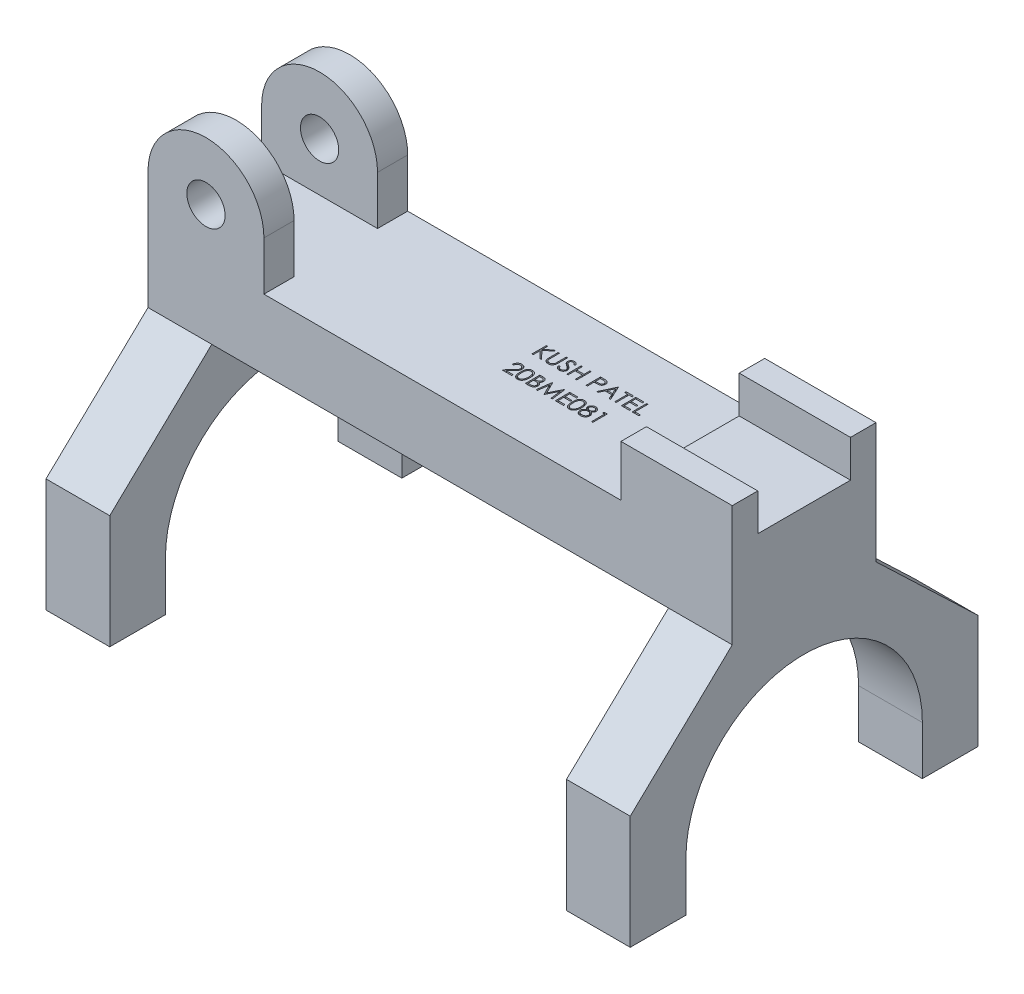
from build123d import *

# Parameters (mm, degrees)
SKETCH1_W             = 13.97
SKETCH1_H             = 46.228
BOSS_EXTRUDE1_DEPTH   = 76.2
BOSS_EXTRUDE1_2_DEPTH = 76.2
CUT_EXTRUDE1_DEPTH    = 128.016
CUT_EXTRUDE2_DEPTH    = 128.016
SKETCH4_W             = 128.016
SKETCH4_H             = 31.496
BOSS_EXTRUDE3_DEPTH   = 15.24
BOSS_EXTRUDE4_DEPTH   = 31.496
SKETCH6_W             = 18.288
SKETCH6_H             = 26.059231169
CUT_EXTRUDE3_DEPTH    = 42.164
SKETCH7_W             = 24.384
SKETCH7_H             = 31.496
BOSS_EXTRUDE5_DEPTH   = 3.048
SKETCH8_W             = 24.384
SKETCH8_H             = 5.588
BOSS_EXTRUDE6_DEPTH   = 8.128
SKETCH9_R             = 4.191
CUT_EXTRUDE4_DEPTH    = 31.496
CUT_EXTRUDE5_DEPTH    = 2.54


with BuildPart() as part:
    # Sketch1 → Boss-Extrude1 (new body)
    with BuildSketch(Plane.XY):
        with Locations((-51.859154672, 23.114)):
            Rectangle(SKETCH1_W, SKETCH1_H)
    extrude(amount=BOSS_EXTRUDE1_DEPTH)


with BuildPart() as body_2:
    # Sketch1 → Boss-Extrude1 2 (new body)
    with BuildSketch(Plane.XY):
        with Locations((62.186845328, 23.114)):
            Rectangle(SKETCH1_W, SKETCH1_H)
    extrude(amount=BOSS_EXTRUDE1_2_DEPTH)


with BuildPart() as cut_extrude1_tool:
    # Sketch2 → Cut-Extrude1 (new body)
    with BuildSketch(Plane(origin=(69.171845328, 0, 0), x_dir=(0, 0, -1), z_dir=(1, 0, 0))):
        with BuildLine():
            Line((-64.008, 10.668), (-64.008, 0))
            Line((-64.008, 0), (-12.192, 0))
            Line((-12.192, 0), (-12.192, 10.668))
            ThreePointArc((-12.192, 10.668), (-38.1, 36.576), (-64.008, 10.668))
        make_face()
    extrude(amount=-CUT_EXTRUDE1_DEPTH)


with BuildPart() as part_1:
    add(part.part)

    # Cut-Extrude1: cut by cut_extrude1_tool
    add(cut_extrude1_tool.part, mode=Mode.SUBTRACT)


with BuildPart() as body_2_1:
    add(body_2.part)

    # Cut-Extrude1: cut by cut_extrude1_tool
    add(cut_extrude1_tool.part, mode=Mode.SUBTRACT)


with BuildPart() as cut_extrude2_tool:
    # Sketch3 → Cut-Extrude2 (new body)
    with BuildSketch(Plane.ZY.offset(58.844154672)):
        Polygon((0, 24.892), (22.352, 46.228), (0, 46.228), align=None)
        Polygon((76.2, 46.228), (53.848, 46.228), (76.2, 24.892), align=None)
    extrude(amount=-CUT_EXTRUDE2_DEPTH)


with BuildPart() as part_2:
    add(part_1.part)

    # Cut-Extrude2: cut by cut_extrude2_tool
    add(cut_extrude2_tool.part, mode=Mode.SUBTRACT)



with BuildPart() as body_2_2:
    add(body_2_1.part)

    # Cut-Extrude2: cut by cut_extrude2_tool
    add(cut_extrude2_tool.part, mode=Mode.SUBTRACT)


with BuildPart() as part_3:
    add(part_2.part)

    add(body_2_2.part)  # Boss-Extrude3 merges body 2
    # Sketch4 → Boss-Extrude3 (add)
    with BuildSketch(Plane(origin=(0, 46.228, 0), x_dir=(1, 0, 0), z_dir=(0, 1, 0))):
        with Locations((5.163845328, -38.1)):
            Rectangle(SKETCH4_W, SKETCH4_H)
    extrude(amount=BOSS_EXTRUDE3_DEPTH)

    # Sketch5 → Boss-Extrude4 (add)
    with BuildSketch(Plane.XY.offset(53.848)):
        with BuildLine():
            Line((-58.844154672, 61.468), (-58.844154672, 72.136))
            ThreePointArc((-58.844154672, 72.136), (-46.144154672, 84.836), (-33.444154672, 72.136))
            Line((-33.444154672, 72.136), (-33.444154672, 61.468))
            Line((-33.444154672, 61.468), (-58.844154672, 61.468))
        make_face()
    extrude(amount=-BOSS_EXTRUDE4_DEPTH)

    # Sketch6 → Cut-Extrude3 (cut)
    with BuildSketch(Plane.ZY.offset(58.844154672)):
        with Locations((38.1, 74.497615585)):
            Rectangle(SKETCH6_W, SKETCH6_H)
    extrude(amount=-CUT_EXTRUDE3_DEPTH, mode=Mode.SUBTRACT)

    # Sketch7 → Boss-Extrude5 (add)
    with BuildSketch(Plane(origin=(0, 61.468, 0), x_dir=(1, 0, 0), z_dir=(0, 1, 0))):
        with Locations((56.979845328, -38.1)):
            Rectangle(SKETCH7_W, SKETCH7_H)
    extrude(amount=BOSS_EXTRUDE5_DEPTH)

    # Sketch8 → Boss-Extrude6 (add)
    with BuildSketch(Plane(origin=(0, 64.516, 0), x_dir=(1, 0, 0), z_dir=(0, 1, 0))):
        with Locations((56.979845328, -51.054)):
            Rectangle(SKETCH8_W, SKETCH8_H)
        with Locations((56.979845328, -25.146)):
            Rectangle(SKETCH8_W, SKETCH8_H)
    extrude(amount=BOSS_EXTRUDE6_DEPTH)

    # Sketch9 → Cut-Extrude4 (cut)
    with BuildSketch(Plane.XY.offset(53.848)):
        with Locations((-46.144154672, 72.136)):
            Circle(SKETCH9_R)
    extrude(amount=-CUT_EXTRUDE4_DEPTH, mode=Mode.SUBTRACT)

    # Sketch10 → Cut-Extrude5 (cut)
    # profile 1 of 17: a face of its own
    with BuildSketch(Plane(origin=(0, 61.468, 0), x_dir=(1, 0, 0), z_dir=(0, 1, 0))):
        Polygon((7.261311191, -32.680807402), (7.546247089, -32.680807402), (7.546247089, -33.889876914), (8.869799773, -32.680807402), (9.276215037, -32.680807402), (7.716063795, -34.10548689), (9.398330422, -35.855807402), (9.018627898, -35.855807402), (7.546247089, -34.323640936), (7.546247089, -35.855807402), (7.261311191, -35.855807402), align=None)
    # profile 2 of 17: a face of its own
    with BuildSketch(Plane(origin=(0, 61.468, 0), x_dir=(1, 0, 0), z_dir=(0, 1, 0))):
        with BuildLine():
            Line((9.866439396, -32.680807402), (10.151375294, -32.680807402))
            Line((10.151375294, -32.680807402), (10.151375294, -34.583136128))
            add(Edge.make_bspline(
                [(10.151375294, -34.583136128), (10.15133289, -34.610060796), (10.151252422, -34.661154992), (10.151789917, -34.733879093), (10.153295201, -34.798533395), (10.154244218, -34.855367118), (10.156355442, -34.904119467), (10.158077241, -34.945054571), (10.160291175, -34.977978597), (10.162951931, -34.997192723), (10.164095646, -35.005451833)],
                knots=[0, 0, 0, 0, 1.528628734, 2.90083645, 4.128790002, 5.200304208, 6.127813768, 6.898992206, 7.526736466, 8, 8, 8, 8], degree=3))
            add(Edge.make_bspline(
                [(10.164095646, -35.005451833), (10.168792341, -35.03524854), (10.177921089, -35.093163016), (10.201186017, -35.175629814), (10.233677607, -35.249953352), (10.27217951, -35.31845288), (10.322918379, -35.379221799), (10.383700158, -35.435203084), (10.457339991, -35.484163222), (10.539219254, -35.528931458), (10.627470863, -35.564913354), (10.717651083, -35.59212162), (10.808404357, -35.608703194), (10.869161306, -35.610623197), (10.899332025, -35.611576633)],
                knots=[0, 0, 0, 0, 1.035780045, 2.013197591, 2.933192213, 3.817615948, 4.702609284, 5.640816605, 6.646850145, 7.73207398, 8.84249596, 9.914020372, 10.964143139, 12, 12, 12, 12], degree=3))
            add(Edge.make_bspline(
                [(10.899332025, -35.611576633), (10.925234346, -35.610602498), (10.976889384, -35.608659853), (11.053639504, -35.59662984), (11.128388174, -35.574948613), (11.201504505, -35.546972546), (11.270040041, -35.51000866), (11.33403302, -35.467308684), (11.391150303, -35.417224532), (11.443272916, -35.361797791), (11.48866175, -35.299259544), (11.528005572, -35.230971519), (11.560232665, -35.15590604), (11.576147148, -35.103151671), (11.58432301, -35.07604979)],
                knots=[0, 0, 0, 0, 0.994687771, 1.983630487, 2.973142513, 3.978332533, 4.983357753, 5.956394766, 6.925816176, 7.893390482, 8.871859704, 9.88551698, 10.913711441, 12, 12, 12, 12], degree=3))
            add(Edge.make_bspline(
                [(11.58432301, -35.07604979), (11.587044552, -35.064847869), (11.593109245, -35.039885475), (11.598776207, -34.997684018), (11.604678556, -34.947891524), (11.608773915, -34.890150237), (11.612766451, -34.82465364), (11.615155024, -34.751060535), (11.616259047, -34.669638149), (11.61658805, -34.612817295), (11.616759909, -34.583136128)],
                knots=[0, 0, 0, 0, 0.558680831, 1.244966039, 2.062412453, 2.990489873, 4.051219941, 5.244515665, 6.560634259, 8, 8, 8, 8], degree=3))
            Line((11.616759909, -34.583136128), (11.616759909, -32.680807402))
            Line((11.616759909, -32.680807402), (11.901695807, -32.680807402))
            Line((11.901695807, -32.680807402), (11.901695807, -34.598400551))
            add(Edge.make_bspline(
                [(11.901695807, -34.598400551), (11.901465283, -34.632961224), (11.901015403, -34.700408477), (11.897114165, -34.799242924), (11.890893887, -34.892998843), (11.882105407, -34.981688836), (11.870460411, -35.064995538), (11.857510747, -35.143649149), (11.841019313, -35.217085078), (11.821757585, -35.285875914), (11.799738009, -35.351358487), (11.771216396, -35.413505587), (11.739081314, -35.474206507), (11.700968022, -35.532543149), (11.658140553, -35.588773808), (11.609652243, -35.642557468), (11.557106754, -35.694753603), (11.499630582, -35.744023313), (11.438171177, -35.789206899), (11.372911359, -35.828937734), (11.304352432, -35.862523444), (11.23267261, -35.890169461), (11.157841305, -35.910956276), (11.079856628, -35.926445882), (10.998541074, -35.935247252), (10.943237422, -35.936555288), (10.915232465, -35.937217659)],
                knots=[0, 0, 0, 0, 1.316592851, 2.569410997, 3.76748051, 4.895814652, 5.963796859, 6.97159953, 7.931736103, 8.829262218, 9.692595152, 10.560224239, 11.431080259, 12.30701507, 13.211635791, 14.121146779, 15.063487852, 16.031507147, 17.00238618, 17.966455255, 18.938106653, 19.907068911, 20.888905087, 21.893141452, 22.933117798, 24, 24, 24, 24], degree=3))
            add(Edge.make_bspline(
                [(10.915232465, -35.937217659), (10.884689779, -35.936505765), (10.824765139, -35.935109031), (10.736465606, -35.927105536), (10.6518163, -35.912030278), (10.569923183, -35.892835186), (10.491901189, -35.866361368), (10.416704993, -35.835429497), (10.345622475, -35.79744084), (10.277500465, -35.755173976), (10.214159437, -35.70761734), (10.156013935, -35.655783039), (10.102967967, -35.600501411), (10.05591565, -35.541173937), (10.014077419, -35.478262031), (9.978036439, -35.411587721), (9.947090853, -35.341176819), (9.931119182, -35.292233559), (9.923044965, -35.267491096)],
                knots=[0, 0, 0, 0, 1.13879206, 2.234305948, 3.301075583, 4.341971843, 5.366689343, 6.369221514, 7.369726634, 8.367512178, 9.355451585, 10.318319045, 11.268648973, 12.207971039, 13.137398894, 14.081662264, 15.030215811, 16, 16, 16, 16], degree=3))
            add(Edge.make_bspline(
                [(9.923044965, -35.267491096), (9.918348543, -35.250588689), (9.908161899, -35.213926993), (9.897253236, -35.153251392), (9.888082855, -35.08338786), (9.879459956, -35.004331613), (9.87437183, -34.916021377), (9.86991101, -34.818495432), (9.86640797, -34.711635852), (9.866428628, -34.637200685), (9.866439396, -34.598400551)],
                knots=[0, 0, 0, 0, 0.625038921, 1.35572334, 2.194682327, 3.136881307, 4.189498639, 5.346923369, 6.617055217, 8, 8, 8, 8], degree=3))
            Line((9.866439396, -34.598400551), (9.866439396, -32.680807402))
        make_face()
    # profile 3 of 17: a face of its own
    with BuildSketch(Plane(origin=(0, 61.468, 0), x_dir=(1, 0, 0), z_dir=(0, 1, 0))):
        with BuildLine():
            Line((12.390157345, -35.243322426), (12.658556784, -35.082409966))
            add(Edge.make_bspline(
                [(12.658556784, -35.082409966), (12.683519757, -35.124196944), (12.731347848, -35.204259181), (12.811132295, -35.312443261), (12.893802865, -35.404393217), (12.97997176, -35.47957414), (13.069113013, -35.538764201), (13.161808548, -35.580676226), (13.25774599, -35.606816432), (13.323036528, -35.60999151), (13.355632105, -35.611576633)],
                knots=[0, 0, 0, 0, 1.272034388, 2.437168799, 3.508375237, 4.49857839, 5.41946034, 6.295179144, 7.148887113, 8, 8, 8, 8], degree=3))
            add(Edge.make_bspline(
                [(13.355632105, -35.611576633), (13.383469471, -35.610801323), (13.438657115, -35.609264269), (13.519902864, -35.594495256), (13.598807785, -35.571805682), (13.67374562, -35.53931098), (13.743682356, -35.499996782), (13.805011287, -35.452511321), (13.858030261, -35.39934712), (13.901399958, -35.340035712), (13.93467399, -35.276248013), (13.960248224, -35.210774114), (13.97444054, -35.142585484), (13.976578452, -35.096674564), (13.977657345, -35.07350572)],
                knots=[0, 0, 0, 0, 1.095163259, 2.171163733, 3.241058638, 4.321873601, 5.38011039, 6.391990106, 7.366004449, 8.327778327, 9.272591725, 10.192022065, 11.087607919, 12, 12, 12, 12], degree=3))
            add(Edge.make_bspline(
                [(13.977657345, -35.07350572), (13.976319935, -35.047070806), (13.973601175, -34.993332489), (13.950621903, -34.914048519), (13.914472944, -34.835587401), (13.881123974, -34.787054111), (13.86381019, -34.761857082)],
                knots=[0, 0, 0, 0, 0.938893495, 1.908633276, 2.914225137, 4, 4, 4, 4], degree=3))
            add(Edge.make_bspline(
                [(13.86381019, -34.761857082), (13.849594704, -34.743671749), (13.81975107, -34.705493917), (13.768445326, -34.64866574), (13.70824178, -34.590047602), (13.641200698, -34.527401172), (13.564879967, -34.463640099), (13.481670008, -34.395723876), (13.389446364, -34.326235302), (13.324767535, -34.279633046), (13.291394324, -34.25558705)],
                knots=[0, 0, 0, 0, 0.722233717, 1.516239348, 2.393582979, 3.351407094, 4.387010283, 5.505090956, 6.712668013, 8, 8, 8, 8], degree=3))
            add(Edge.make_bspline(
                [(13.291394324, -34.25558705), (13.257989699, -34.231793974), (13.1941226, -34.186303425), (13.1048066, -34.118789967), (13.024937694, -34.057064457), (12.954870872, -34.000545817), (12.894636952, -33.949226383), (12.843761286, -33.903598967), (12.803539881, -33.862429594), (12.781173747, -33.835722091), (12.771131904, -33.82373108)],
                knots=[0, 0, 0, 0, 1.452282411, 2.77665338, 3.964542531, 5.026858415, 5.96415736, 6.766646006, 7.446254459, 8, 8, 8, 8], degree=3))
            add(Edge.make_bspline(
                [(12.771131904, -33.82373108), (12.757096095, -33.805042997), (12.729492794, -33.768290373), (12.693056489, -33.71084568), (12.662087391, -33.652041718), (12.637810133, -33.59172047), (12.617366563, -33.530728784), (12.603616154, -33.468270868), (12.595006101, -33.404626979), (12.59412437, -33.361797589), (12.593682986, -33.340357683)],
                knots=[0, 0, 0, 0, 1.068054152, 2.10047183, 3.106115577, 4.101338837, 5.06977816, 6.043150881, 7.020423561, 8, 8, 8, 8], degree=3))
            add(Edge.make_bspline(
                [(12.593682986, -33.340357683), (12.594866997, -33.306766387), (12.597209712, -33.240301787), (12.617022181, -33.143209533), (12.64829402, -33.050511855), (12.692104383, -32.963126481), (12.748580696, -32.883328769), (12.813936687, -32.810200821), (12.891779964, -32.748725035), (12.977189843, -32.695011239), (13.070676695, -32.652968864), (13.168639872, -32.621254261), (13.271235073, -32.603284434), (13.340725059, -32.60070564), (13.375984669, -32.599397146)],
                knots=[0, 0, 0, 0, 1.005424448, 1.989358655, 2.955360095, 3.929531133, 4.905563448, 5.876582895, 6.856512386, 7.866279853, 8.892233794, 9.918561126, 10.94386622, 12, 12, 12, 12], degree=3))
            add(Edge.make_bspline(
                [(13.375984669, -32.599397146), (13.41339896, -32.600687603), (13.487804043, -32.603253912), (13.597250117, -32.625567386), (13.702624481, -32.66248871), (13.787390872, -32.704388421), (13.853732734, -32.746236206), (13.90432657, -32.784354189), (13.955595972, -32.828237323), (14.007954493, -32.878002496), (14.060514948, -32.934106335), (14.114057651, -32.996164603), (14.168707809, -33.06379805), (14.203864911, -33.112080276), (14.221888114, -33.136832042)],
                knots=[0, 0, 0, 0, 1.286793592, 2.559021753, 3.825965368, 5.121522368, 5.803751409, 6.523245864, 7.299691795, 8.125521123, 9.008227632, 9.944561021, 10.946284179, 12, 12, 12, 12], degree=3))
            Line((14.221888114, -33.136832042), (13.964300975, -33.332089454))
            add(Edge.make_bspline(
                [(13.964300975, -33.332089454), (13.948747165, -33.312051856), (13.918794163, -33.273464128), (13.873319557, -33.219424434), (13.830458284, -33.170060913), (13.788230421, -33.12718469), (13.748866198, -33.088447755), (13.710660024, -33.055282833), (13.67416172, -33.027364971), (13.628154236, -32.99757117), (13.570353163, -32.968037771), (13.497795763, -32.943046821), (13.42197107, -32.928029015), (13.370327762, -32.926043381), (13.344183787, -32.925038172)],
                knots=[0, 0, 0, 0, 1.181633172, 2.275549214, 3.290209073, 4.226197932, 5.078386478, 5.862611352, 6.581680152, 7.217281963, 8.414376989, 9.595101626, 10.782541182, 12, 12, 12, 12], degree=3))
            add(Edge.make_bspline(
                [(13.344183787, -32.925038172), (13.311384656, -32.926137357), (13.248134622, -32.928257031), (13.158336336, -32.951407304), (13.077515419, -32.987857991), (13.008071306, -33.038943721), (12.950252763, -33.099469193), (12.908428525, -33.169118583), (12.883255161, -33.246028334), (12.880183322, -33.299678265), (12.878618884, -33.327001313)],
                knots=[0, 0, 0, 0, 1.14458467, 2.207223713, 3.21896685, 4.227309161, 5.202851033, 6.127160689, 7.046193047, 8, 8, 8, 8], degree=3))
            add(Edge.make_bspline(
                [(12.878618884, -33.327001313), (12.878975506, -33.344011582), (12.879689333, -33.378059937), (12.889645042, -33.428362299), (12.902435148, -33.478537585), (12.922703106, -33.528360214), (12.950684203, -33.578701525), (12.987428184, -33.630428387), (13.033704546, -33.683996723), (13.069152979, -33.718837698), (13.087868683, -33.737232683)],
                knots=[0, 0, 0, 0, 0.858281714, 1.717966888, 2.583508476, 3.4729293, 4.427298488, 5.488583878, 6.674047936, 8, 8, 8, 8], degree=3))
            add(Edge.make_bspline(
                [(13.087868683, -33.737232683), (13.094818642, -33.743434842), (13.111330155, -33.758169752), (13.141516173, -33.78229275), (13.181378569, -33.81204955), (13.229876423, -33.848868045), (13.287903958, -33.891577657), (13.355467555, -33.939632291), (13.431814089, -33.994591957), (13.485990398, -34.033016297), (13.514636512, -34.053333444)],
                knots=[0, 0, 0, 0, 0.420754252, 0.999615792, 1.744751191, 2.668019286, 3.750313428, 4.999500688, 6.413464383, 8, 8, 8, 8], degree=3))
            add(Edge.make_bspline(
                [(13.514636512, -34.053333444), (13.549095162, -34.078408106), (13.615819561, -34.126961713), (13.710758937, -34.199910223), (13.796841178, -34.271254985), (13.874368512, -34.340540385), (13.944106851, -34.40724087), (14.005282497, -34.472158898), (14.058518793, -34.534829381), (14.11583137, -34.615177361), (14.174394535, -34.713857344), (14.224687902, -34.834759746), (14.256400117, -34.956132123), (14.260547135, -35.03770861), (14.262593243, -35.077957843)],
                knots=[0, 0, 0, 0, 1.163667725, 2.253281268, 3.268753668, 4.215851969, 5.092017293, 5.902905408, 6.650798638, 7.335211899, 8.59617414, 9.77448103, 10.901945474, 12, 12, 12, 12], degree=3))
            add(Edge.make_bspline(
                [(14.262593243, -35.077957843), (14.261997124, -35.106422503), (14.260816464, -35.162799058), (14.247244778, -35.245580449), (14.227360511, -35.325981309), (14.19739102, -35.403007819), (14.160812155, -35.478069139), (14.114397058, -35.549196306), (14.060596516, -35.617963539), (13.998880172, -35.682537135), (13.931347103, -35.741815469), (13.859969752, -35.794546832), (13.78463129, -35.838514526), (13.705740417, -35.87439279), (13.623279012, -35.902453909), (13.537274808, -35.922785583), (13.447586037, -35.935263978), (13.3866256, -35.936559162), (13.355632105, -35.937217659)],
                knots=[0, 0, 0, 0, 0.983748083, 1.948392443, 2.894712957, 3.844097841, 4.80183111, 5.778335162, 6.776009319, 7.81870978, 8.863265674, 9.881300176, 10.883814829, 11.87499822, 12.874611388, 13.892143829, 14.928324115, 16, 16, 16, 16], degree=3))
            add(Edge.make_bspline(
                [(13.355632105, -35.937217659), (13.331651472, -35.936753944), (13.283992218, -35.935832355), (13.213498617, -35.92768505), (13.144429132, -35.916157892), (13.077650462, -35.897857128), (13.012302239, -35.875653014), (12.948668676, -35.84831324), (12.886718934, -35.815549779), (12.826105841, -35.778089292), (12.766983554, -35.734494053), (12.709906609, -35.683718095), (12.653002276, -35.627161816), (12.597950138, -35.563289376), (12.543636643, -35.493132687), (12.491132657, -35.416035356), (12.439351384, -35.332417328), (12.406861639, -35.273575429), (12.390157345, -35.243322426)],
                knots=[0, 0, 0, 0, 0.915332311, 1.819136955, 2.706846663, 3.586547465, 4.459518054, 5.340707479, 6.227863349, 7.133153174, 8.059268498, 9.028702269, 10.047606654, 11.120612155, 12.245963614, 13.433783089, 14.680604001, 16, 16, 16, 16], degree=3))
        make_face()
    # profile 4 of 17: a face of its own
    with BuildSketch(Plane(origin=(0, 61.468, 0), x_dir=(1, 0, 0), z_dir=(0, 1, 0))):
        Polygon((14.913875294, -32.680807402), (15.198811191, -32.680807402), (15.198811191, -33.983371505), (16.827016319, -33.983371505), (16.827016319, -32.680807402), (17.111952217, -32.680807402), (17.111952217, -35.855807402), (16.827016319, -35.855807402), (16.827016319, -34.309012531), (15.198811191, -34.309012531), (15.198811191, -35.855807402), (14.913875294, -35.855807402), align=None)
    # profile 5 of 17: a face of its own
    with BuildSketch(Plane(origin=(0, 61.468, 0), x_dir=(1, 0, 0), z_dir=(0, 1, 0))):
        with BuildLine():
            Line((19.147208627, -32.680807402), (19.769869885, -32.680807402))
            add(Edge.make_bspline(
                [(19.769869885, -32.680807402), (19.812696921, -32.68085448), (19.894755425, -32.680944682), (20.012425511, -32.683679487), (20.119295768, -32.687332272), (20.215135756, -32.692395847), (20.300240359, -32.698379896), (20.374224481, -32.706772818), (20.43766965, -32.715536086), (20.475684786, -32.724445505), (20.493021928, -32.728508724)],
                knots=[0, 0, 0, 0, 1.415646017, 2.712440637, 3.8905458, 4.950247383, 5.884950622, 6.709939814, 7.411656543, 8, 8, 8, 8], degree=3))
            add(Edge.make_bspline(
                [(20.493021928, -32.728508724), (20.51496892, -32.734515779), (20.558345749, -32.746388339), (20.620848838, -32.770167931), (20.680315541, -32.798363895), (20.736949883, -32.830498469), (20.790055916, -32.867950374), (20.840425967, -32.909201442), (20.887615521, -32.955204079), (20.931359212, -33.005442321), (20.97153185, -33.059072797), (21.006120919, -33.116896106), (21.035083475, -33.177938931), (21.059924014, -33.242158814), (21.077802398, -33.310095036), (21.091270657, -33.381275553), (21.099819233, -33.455692737), (21.100637986, -33.506547045), (21.101054781, -33.532435007)],
                knots=[0, 0, 0, 0, 0.999701418, 1.975846123, 2.934577507, 3.890451536, 4.834027766, 5.787354733, 6.749476667, 7.726910423, 8.712836071, 9.690891519, 10.682875813, 11.679750201, 12.712814741, 13.765529915, 14.8625177, 16, 16, 16, 16], degree=3))
            add(Edge.make_bspline(
                [(21.101054781, -33.532435007), (21.100672489, -33.558540561), (21.099924508, -33.609617842), (21.090947163, -33.684341728), (21.078854775, -33.755750554), (21.06026102, -33.823685984), (21.03590816, -33.887744576), (21.007340369, -33.948905265), (20.972883881, -34.006127538), (20.933291785, -34.059619138), (20.889248553, -34.109430273), (20.840940531, -34.155199979), (20.788562744, -34.196660343), (20.732281652, -34.233904312), (20.671548575, -34.266068223), (20.607284622, -34.294876635), (20.538931211, -34.319071097), (20.491630502, -34.331798367), (20.467581223, -34.338269341)],
                knots=[0, 0, 0, 0, 1.121902311, 2.195077645, 3.232258892, 4.234102512, 5.217864754, 6.176164875, 7.132989551, 8.084763148, 9.034132444, 9.988522005, 10.94243251, 11.903244335, 12.886203696, 13.894208494, 14.929344452, 16, 16, 16, 16], degree=3))
            add(Edge.make_bspline(
                [(20.467581223, -34.338269341), (20.447689999, -34.342499331), (20.404097224, -34.3517696), (20.332303469, -34.362118701), (20.24871444, -34.370952095), (20.153444229, -34.37757527), (20.046578351, -34.383245247), (19.928058996, -34.387752018), (19.797653512, -34.390228386), (19.706693169, -34.390356105), (19.659202818, -34.390422787)],
                knots=[0, 0, 0, 0, 0.601384939, 1.31797006, 2.144135048, 3.087295005, 4.142315834, 5.309527816, 6.595305764, 8, 8, 8, 8], degree=3))
            Line((19.659202818, -34.390422787), (19.432144525, -34.390422787))
            Line((19.432144525, -34.390422787), (19.432144525, -35.855807402))
            Line((19.432144525, -35.855807402), (19.147208627, -35.855807402))
            Line((19.147208627, -35.855807402), (19.147208627, -32.680807402))
        make_face()
        with BuildLine():
            Line((19.432144525, -33.006448428), (19.432144525, -34.064781761))
            Line((19.432144525, -34.064781761), (19.988023932, -34.071777955))
            add(Edge.make_bspline(
                [(19.988023932, -34.071777955), (20.015165579, -34.071791983), (20.067561969, -34.071819063), (20.143250542, -34.068203896), (20.213471825, -34.064030556), (20.278010118, -34.057920111), (20.336894516, -34.04928297), (20.390223203, -34.040563751), (20.437582666, -34.0279496), (20.493008371, -34.010965102), (20.554769693, -33.981997658), (20.621959541, -33.939951686), (20.67890143, -33.886357044), (20.728175885, -33.826097511), (20.767279074, -33.759060444), (20.795904867, -33.687333622), (20.812724345, -33.611652645), (20.814979678, -33.559865547), (20.816118884, -33.533707042)],
                knots=[0, 0, 0, 0, 1.160613943, 2.240541288, 3.23993089, 4.169200891, 5.011653406, 5.7853311, 6.478053781, 7.106038997, 8.262395093, 9.384106736, 10.481365981, 11.59014053, 12.70357646, 13.786202915, 14.881775077, 16, 16, 16, 16], degree=3))
            add(Edge.make_bspline(
                [(20.816118884, -33.533707042), (20.814973483, -33.50818139), (20.812696568, -33.457439554), (20.795773035, -33.383073107), (20.767334729, -33.312102147), (20.727913389, -33.245905134), (20.68006965, -33.185862433), (20.624462389, -33.133704325), (20.561222502, -33.091774637), (20.502395892, -33.064711589), (20.450143388, -33.048187732), (20.404757253, -33.036626341), (20.353512141, -33.027395612), (20.296391369, -33.019921206), (20.23383767, -33.013522709), (20.165313627, -33.009181144), (20.091078822, -33.006639823), (20.039543519, -33.006513771), (20.012828619, -33.006448428)],
                knots=[0, 0, 0, 0, 1.120700087, 2.227813068, 3.331159281, 4.466773991, 5.599788987, 6.693661531, 7.80175334, 8.91857717, 9.525282508, 10.207424825, 10.974604443, 11.810962634, 12.737642355, 13.736264703, 14.826523623, 16, 16, 16, 16], degree=3))
            Line((20.012828619, -33.006448428), (19.432144525, -33.006448428))
        make_face(mode=Mode.SUBTRACT)
    # profile 6 of 17: a face of its own
    with BuildSketch(Plane(origin=(0, 61.468, 0), x_dir=(1, 0, 0), z_dir=(0, 1, 0))):
        Polygon((23.054900935, -32.680807402), (24.52028555, -35.855807402), (24.210544965, -35.855807402), (23.741163956, -34.838179197), (22.301856063, -34.838179197), (21.819118683, -35.855807402), (21.508106063, -35.855807402), (23.014195807, -32.680807402), align=None)
        Polygon((23.031368283, -33.299652555), (22.456408347, -34.512538172), (23.591063795, -34.512538172), align=None, mode=Mode.SUBTRACT)
    # profile 7 of 17: a face of its own
    with BuildSketch(Plane(origin=(0, 61.468, 0), x_dir=(1, 0, 0), z_dir=(0, 1, 0))):
        Polygon((24.723811191, -33.006448428), (24.723811191, -32.680807402), (26.392721448, -32.680807402), (26.392721448, -33.006448428), (25.700734268, -33.006448428), (25.700734268, -35.855807402), (25.415798371, -35.855807402), (25.415798371, -33.006448428), align=None)
    # profile 8 of 17: a face of its own
    with BuildSketch(Plane(origin=(0, 61.468, 0), x_dir=(1, 0, 0), z_dir=(0, 1, 0))):
        Polygon((26.881182986, -32.680807402), (28.672208627, -32.680807402), (28.672208627, -33.006448428), (27.166118884, -33.006448428), (27.166118884, -33.983371505), (28.672208627, -33.983371505), (28.672208627, -34.309012531), (27.166118884, -34.309012531), (27.166118884, -35.530166377), (28.672208627, -35.530166377), (28.672208627, -35.855807402), (26.881182986, -35.855807402), align=None)
    # profile 9 of 17: a face of its own
    with BuildSketch(Plane(origin=(0, 61.468, 0), x_dir=(1, 0, 0), z_dir=(0, 1, 0))):
        Polygon((29.242080422, -32.680807402), (29.527016319, -32.680807402), (29.527016319, -35.530166377), (30.748170166, -35.530166377), (30.748170166, -35.855807402), (29.242080422, -35.855807402), align=None)
    # profile 10 of 17: a face of its own
    with BuildSketch(Plane(origin=(0, 61.468, 0), x_dir=(1, 0, 0), z_dir=(0, 1, 0))):
        with BuildLine():
            Line((7.383426576, -39.949397146), (7.098490678, -39.949397146))
            add(Edge.make_bspline(
                [(7.098490678, -39.949397146), (7.100347739, -39.911595698), (7.103994956, -39.83735466), (7.121074904, -39.72911083), (7.145514128, -39.625646834), (7.180068518, -39.527793412), (7.22298207, -39.434685351), (7.274444309, -39.34669248), (7.335398731, -39.264150473), (7.404529125, -39.187824522), (7.479612105, -39.117804369), (7.56062535, -39.057338541), (7.645756196, -39.006250368), (7.734746366, -38.963540956), (7.828599877, -38.931482667), (7.926465041, -38.907695894), (8.028771829, -38.893384495), (8.098476706, -38.891846175), (8.133927377, -38.891063813)],
                knots=[0, 0, 0, 0, 1.10065271, 2.161652631, 3.183658789, 4.190468796, 5.17591951, 6.163126047, 7.15150782, 8.156236427, 9.156009102, 10.134482811, 11.092018607, 12.041330605, 13.001268258, 13.972401359, 14.968799086, 16, 16, 16, 16], degree=3))
            add(Edge.make_bspline(
                [(8.133927377, -38.891063813), (8.168741773, -38.891878841), (8.237150817, -38.893480343), (8.336992787, -38.907233562), (8.432040762, -38.928774206), (8.52210895, -38.958996048), (8.606478737, -38.999621921), (8.685783927, -39.048423974), (8.760968663, -39.10486625), (8.828647674, -39.171317923), (8.890794288, -39.242258658), (8.944408477, -39.317994113), (8.990321847, -39.396216394), (9.028592099, -39.477521977), (9.056764454, -39.56267641), (9.078153257, -39.650439944), (9.090243125, -39.741721022), (9.092098616, -39.803503398), (9.09304196, -39.834913973)],
                knots=[0, 0, 0, 0, 1.111607364, 2.184268762, 3.212621178, 4.221274766, 5.211760367, 6.196651075, 7.1921475, 8.207485113, 9.220403448, 10.201281604, 11.166441695, 12.114753415, 13.065576456, 14.026450734, 14.996634279, 16, 16, 16, 16], degree=3))
            add(Edge.make_bspline(
                [(9.09304196, -39.834913973), (9.091505929, -39.879135223), (9.088460822, -39.966801702), (9.06241278, -40.095629471), (9.021730588, -40.220446358), (8.972747271, -40.320900911), (8.923332983, -40.401848437), (8.878803601, -40.468495048), (8.826674808, -40.540255009), (8.766187885, -40.616888022), (8.698594065, -40.698994343), (8.623281103, -40.786524372), (8.539711944, -40.878573763), (8.481057447, -40.941443844), (8.450664156, -40.974021545)],
                knots=[0, 0, 0, 0, 1.184426356, 2.348067706, 3.509069118, 4.696110526, 5.333549288, 6.050745305, 6.844228056, 7.710549037, 8.667450064, 9.695053472, 10.805634456, 12, 12, 12, 12], degree=3))
            Line((8.450664156, -40.974021545), (7.656278138, -41.821833043))
            Line((7.656278138, -41.821833043), (9.133747089, -41.821833043))
            Line((9.133747089, -41.821833043), (9.133747089, -42.147474069))
            Line((9.133747089, -42.147474069), (6.976375294, -42.147474069))
            Line((6.976375294, -42.147474069), (8.207705422, -40.833461649))
            add(Edge.make_bspline(
                [(8.207705422, -40.833461649), (8.237684576, -40.802166757), (8.295268397, -40.742055673), (8.37671402, -40.654295988), (8.449865102, -40.572880333), (8.515195166, -40.497962536), (8.571286988, -40.428446756), (8.621063942, -40.366584418), (8.660947014, -40.309657167), (8.704231694, -40.243671038), (8.746154377, -40.163105579), (8.782179157, -40.064650018), (8.804145484, -39.963297439), (8.806780585, -39.894806305), (8.808106063, -39.860354678)],
                knots=[0, 0, 0, 0, 1.329631726, 2.553950428, 3.673215718, 4.687767853, 5.603093632, 6.413772471, 7.123043292, 7.734684054, 8.834405432, 9.900288307, 10.943827018, 12, 12, 12, 12], degree=3))
            add(Edge.make_bspline(
                [(8.808106063, -39.860354678), (8.807529354, -39.838690838), (8.806392771, -39.795995569), (8.79636186, -39.733397488), (8.781203044, -39.673013693), (8.759481274, -39.614658445), (8.730809445, -39.558918461), (8.695908593, -39.50572589), (8.655640464, -39.4543009), (8.609057527, -39.406083265), (8.55788422, -39.361922457), (8.503823722, -39.322802751), (8.44662827, -39.290110129), (8.386539017, -39.263309957), (8.323723484, -39.242286575), (8.258060179, -39.22771915), (8.189730536, -39.218572896), (8.143073008, -39.217335398), (8.119298972, -39.216704838)],
                knots=[0, 0, 0, 0, 0.991446411, 1.95395049, 2.89581595, 3.838931463, 4.798493298, 5.75982156, 6.748411868, 7.785213223, 8.824556874, 9.840280684, 10.836137867, 11.835679398, 12.848801643, 13.863922112, 14.911575587, 16, 16, 16, 16], degree=3))
            add(Edge.make_bspline(
                [(8.119298972, -39.216704838), (8.094469716, -39.217353475), (8.045709158, -39.218627289), (7.974118321, -39.227537849), (7.905823366, -39.242910147), (7.840652497, -39.263934702), (7.778495444, -39.290657814), (7.71965449, -39.323942468), (7.664261726, -39.363660351), (7.612213023, -39.408691427), (7.564257842, -39.458827037), (7.52212389, -39.514716075), (7.485308391, -39.575338087), (7.453187158, -39.640529501), (7.427101639, -39.710881858), (7.407168853, -39.786145419), (7.391396499, -39.865993387), (7.386127341, -39.921134142), (7.383426576, -39.949397146)],
                knots=[0, 0, 0, 0, 1.031018746, 2.02475058, 2.990194455, 3.934040569, 4.864654155, 5.795059489, 6.735614925, 7.690564532, 8.649604399, 9.611025574, 10.590972636, 11.591080095, 12.624614302, 13.701020113, 14.821632451, 16, 16, 16, 16], degree=3))
        make_face()
    # profile 11 of 17: a face of its own
    with BuildSketch(Plane(origin=(0, 61.468, 0), x_dir=(1, 0, 0), z_dir=(0, 1, 0))):
        with BuildLine():
            add(Edge.make_bspline(
                [(9.418682986, -40.561246104), (9.418980545, -40.51035776), (9.419558559, -40.411506417), (9.425988769, -40.267466063), (9.436670687, -40.132337801), (9.451309589, -40.006115162), (9.469124043, -39.888765562), (9.492905234, -39.780602603), (9.519949705, -39.681125675), (9.55129371, -39.590010388), (9.586661204, -39.506029186), (9.62515514, -39.427629182), (9.668303204, -39.354929), (9.713639404, -39.28676829), (9.762998926, -39.224262796), (9.814977114, -39.166529809), (9.871602673, -39.114903628), (9.930950688, -39.067871625), (9.993558481, -39.026642462), (10.057641471, -38.990327049), (10.123640745, -38.959302884), (10.191736497, -38.934909417), (10.261316674, -38.914761006), (10.332624513, -38.90098246), (10.405777751, -38.892312979), (10.455154838, -38.891484152), (10.480196408, -38.891063813)],
                knots=[0, 0, 0, 0, 1.646270934, 3.197905019, 4.663502075, 6.030701355, 7.308322542, 8.50163776, 9.611534131, 10.641858119, 11.616356847, 12.558055219, 13.465016945, 14.349605745, 15.204443733, 16.039544428, 16.859896111, 17.680448484, 18.487036065, 19.28249412, 20.06191084, 20.843045899, 21.620316918, 22.403196591, 23.190181807, 24, 24, 24, 24], degree=3))
            add(Edge.make_bspline(
                [(10.480196408, -38.891063813), (10.505447163, -38.891506331), (10.555662971, -38.89238636), (10.629903883, -38.900844508), (10.702429666, -38.914879027), (10.77293112, -38.934764482), (10.841987358, -38.959434846), (10.909058242, -38.990356731), (10.97456038, -39.026351132), (11.037452855, -39.068645649), (11.098426114, -39.115801), (11.15598248, -39.169107135), (11.210127194, -39.228025809), (11.261539792, -39.291926642), (11.308761655, -39.362035255), (11.35373184, -39.437132269), (11.393983616, -39.518530982), (11.432750071, -39.604873264), (11.466211837, -39.698548154), (11.496389074, -39.799027615), (11.520772139, -39.907498485), (11.541082407, -40.02339165), (11.556816706, -40.147132724), (11.568276317, -40.278456453), (11.574329758, -40.417449236), (11.575469766, -40.512479571), (11.576054781, -40.561246104)],
                knots=[0, 0, 0, 0, 0.810914788, 1.612654377, 2.396697861, 3.181598691, 3.963628158, 4.749916497, 5.551656086, 6.361998678, 7.18212741, 8.025565596, 8.878627764, 9.750805457, 10.657531673, 11.591944965, 12.560506719, 13.57287815, 14.630710178, 15.753379473, 16.941251878, 18.199788006, 19.531962791, 20.947069417, 22.433333509, 24, 24, 24, 24], degree=3))
            add(Edge.make_bspline(
                [(11.576054781, -40.561246104), (11.575463701, -40.609799935), (11.574312005, -40.704405094), (11.568344178, -40.842772479), (11.556588848, -40.973399275), (11.541884073, -41.096598766), (11.521517843, -41.211858178), (11.496476013, -41.319576356), (11.468671792, -41.420218478), (11.434350229, -41.512960057), (11.396784798, -41.599094834), (11.355913299, -41.679528605), (11.312125671, -41.754972313), (11.264420167, -41.824822083), (11.213571713, -41.889572722), (11.158492005, -41.94808128), (11.100733688, -42.001757532), (11.039580997, -42.04952008), (10.975707661, -42.091325582), (10.910430498, -42.128712432), (10.842591286, -42.158859234), (10.773727394, -42.184744592), (10.702853804, -42.204520716), (10.630058864, -42.218194857), (10.55571285, -42.227785034), (10.505455716, -42.228516626), (10.480196408, -42.228884325)],
                knots=[0, 0, 0, 0, 1.561518951, 3.042555995, 4.452378317, 5.7783523, 7.031515105, 8.214008947, 9.334062868, 10.386615937, 11.391082383, 12.354592575, 13.286541444, 14.194233754, 15.072674879, 15.931287219, 16.775624067, 17.606195743, 18.42308326, 19.229000347, 20.022332153, 20.807536673, 21.593273796, 22.3848459, 23.188221202, 24, 24, 24, 24], degree=3))
            add(Edge.make_bspline(
                [(10.480196408, -42.228884325), (10.455155533, -42.228461274), (10.405779815, -42.2276271), (10.332616544, -42.218996787), (10.261603184, -42.20512158), (10.192389314, -42.185693661), (10.124619833, -42.161913059), (10.059218201, -42.130930789), (9.995457231, -42.09524917), (9.933507034, -42.054613323), (9.874531717, -42.008057225), (9.81819941, -41.956563906), (9.765925286, -41.898848383), (9.717271499, -41.835821981), (9.671030719, -41.76806454), (9.628495359, -41.694650944), (9.589151798, -41.61587229), (9.553189489, -41.531219614), (9.52130463, -41.439457644), (9.493139923, -41.339536603), (9.470902081, -41.230574562), (9.451867543, -41.113446665), (9.436514709, -40.987649599), (9.426033286, -40.853115072), (9.419555093, -40.709926918), (9.418978993, -40.611710766), (9.418682986, -40.561246104)],
                knots=[0, 0, 0, 0, 0.810891512, 1.598919785, 2.382837074, 3.152667961, 3.926044502, 4.706494248, 5.493654104, 6.291793342, 7.103789334, 7.925228297, 8.761435821, 9.622817696, 10.50288917, 11.416980706, 12.369136599, 13.353924996, 14.394355917, 15.514179734, 16.714354668, 17.994756427, 19.357759367, 20.818452758, 22.365282078, 24, 24, 24, 24], degree=3))
        make_face()
        with BuildLine():
            add(Edge.make_bspline(
                [(9.703618884, -40.559974069), (9.703727239, -40.602381817), (9.703937536, -40.684686929), (9.709431375, -40.804287602), (9.716915514, -40.915839257), (9.726568691, -41.019483537), (9.740904223, -41.114869619), (9.756966809, -41.202653546), (9.776514004, -41.282370754), (9.799641628, -41.354568268), (9.825984237, -41.420471352), (9.854745985, -41.481795311), (9.885643926, -41.539264568), (9.920223441, -41.592362913), (9.957883534, -41.641263504), (9.997773562, -41.686831859), (10.041382264, -41.727469121), (10.101710659, -41.776207054), (10.181354604, -41.826570839), (10.281703159, -41.870427649), (10.384816683, -41.897988878), (10.454803888, -41.901493856), (10.489736672, -41.9032433)],
                knots=[0, 0, 0, 0, 1.459021318, 2.831673884, 4.118529203, 5.306027144, 6.411944654, 7.436330062, 8.375795394, 9.233974572, 10.042671642, 10.816086306, 11.563610507, 12.285937304, 12.993564865, 13.685989202, 14.367179055, 15.041617293, 16.353048772, 17.594441528, 18.799311195, 20, 20, 20, 20], degree=3))
            add(Edge.make_bspline(
                [(10.489736672, -41.9032433), (10.524895417, -41.901793884), (10.595140317, -41.898898046), (10.697768831, -41.870959191), (10.797400576, -41.828804681), (10.875480122, -41.778959443), (10.934882144, -41.731490173), (10.977442556, -41.691018314), (11.016505986, -41.645701205), (11.053555582, -41.596806844), (11.087536315, -41.543401091), (11.118436447, -41.485740755), (11.146633484, -41.423665715), (11.162698119, -41.380331737), (11.170911552, -41.358176192)],
                knots=[0, 0, 0, 0, 1.353760809, 2.704726607, 4.075137775, 5.516104923, 6.260822281, 7.007110065, 7.778089737, 8.566572457, 9.372053459, 10.217411131, 11.088608312, 12, 12, 12, 12], degree=3))
            add(Edge.make_bspline(
                [(11.170911552, -41.358176192), (11.180483513, -41.329846357), (11.199918698, -41.272324643), (11.224966522, -41.183094758), (11.244692705, -41.089475108), (11.262439473, -40.992025181), (11.274552602, -40.890026309), (11.284302404, -40.783794089), (11.290045242, -40.673248425), (11.290757123, -40.59814154), (11.291118884, -40.559974069)],
                knots=[0, 0, 0, 0, 0.884706709, 1.796334032, 2.740027952, 3.714592787, 4.726048262, 5.777819803, 6.87074269, 8, 8, 8, 8], degree=3))
            add(Edge.make_bspline(
                [(11.291118884, -40.559974069), (11.290619783, -40.521812771), (11.289643437, -40.447161114), (11.285911462, -40.337833908), (11.276274362, -40.233995296), (11.265570876, -40.135197939), (11.249789111, -40.041988736), (11.232773101, -39.953587387), (11.209912001, -39.871089072), (11.185491919, -39.793202166), (11.157542489, -39.720811572), (11.126776073, -39.65357978), (11.093917763, -39.591182208), (11.058228731, -39.533790054), (11.020132647, -39.481146247), (10.978624013, -39.434306294), (10.935349332, -39.391818473), (10.874736599, -39.343320285), (10.795384922, -39.29387039), (10.69664637, -39.248362879), (10.593893714, -39.222229642), (10.524430653, -39.218545112), (10.489736672, -39.216704838)],
                knots=[0, 0, 0, 0, 1.31362396, 2.569729283, 3.763502607, 4.902122613, 5.988968491, 7.01645872, 7.998833611, 8.933434873, 9.825090667, 10.667526885, 11.477055099, 12.250526234, 12.991942729, 13.710640831, 14.402115721, 15.076753259, 16.378508321, 17.609869233, 18.806226677, 20, 20, 20, 20], degree=3))
            add(Edge.make_bspline(
                [(10.489736672, -39.216704838), (10.454620635, -39.218547651), (10.384324588, -39.222236632), (10.280503943, -39.248265512), (10.180986424, -39.293634417), (10.101844583, -39.343484069), (10.041189576, -39.390962395), (9.998478847, -39.432134392), (9.958431963, -39.477170637), (9.921540549, -39.526520946), (9.886988128, -39.579557386), (9.855255352, -39.636697194), (9.826664632, -39.698229932), (9.800280802, -39.764103412), (9.77708263, -39.836294698), (9.757947392, -39.915913713), (9.740269851, -40.00341843), (9.727755572, -40.099321126), (9.716630593, -40.202991365), (9.709481085, -40.314821504), (9.703919158, -40.434622763), (9.70372098, -40.517353428), (9.703618884, -40.559974069)],
                knots=[0, 0, 0, 0, 1.207732386, 2.417664972, 3.655092373, 4.956220595, 5.625982001, 6.301752483, 6.994047911, 7.697131622, 8.419323945, 9.170223765, 9.943494443, 10.752040957, 11.610060368, 12.549350801, 13.567764191, 14.679664412, 15.874934091, 17.154273443, 18.533957287, 20, 20, 20, 20], degree=3))
        make_face(mode=Mode.SUBTRACT)
    # profile 12 of 17: a face of its own
    with BuildSketch(Plane(origin=(0, 61.468, 0), x_dir=(1, 0, 0), z_dir=(0, 1, 0))):
        with BuildLine():
            Line((12.145926576, -38.972474069), (12.765407746, -38.972474069))
            add(Edge.make_bspline(
                [(12.765407746, -38.972474069), (12.795732151, -38.9726335), (12.854508395, -38.972942516), (12.939978889, -38.977735071), (13.020033167, -38.984269829), (13.094694446, -38.994638555), (13.163928226, -39.007149668), (13.227943154, -39.022300601), (13.286535668, -39.0404676), (13.356487936, -39.069356727), (13.436244535, -39.112285601), (13.522603077, -39.175720799), (13.596448352, -39.253310962), (13.660117368, -39.340834514), (13.710736955, -39.437114821), (13.747357675, -39.539857085), (13.770542319, -39.647736094), (13.772926684, -39.72179812), (13.774131704, -39.759227875)],
                knots=[0, 0, 0, 0, 1.001505555, 1.941167018, 2.826882275, 3.653841531, 4.429895133, 5.150066043, 5.825578002, 6.45369114, 7.647487171, 8.808567382, 9.977351308, 11.170798116, 12.373658725, 13.556498008, 14.765093433, 16, 16, 16, 16], degree=3))
            add(Edge.make_bspline(
                [(13.774131704, -39.759227875), (13.773139999, -39.794291265), (13.771191204, -39.863194132), (13.752555987, -39.96397236), (13.723381666, -40.059903823), (13.682827619, -40.150638415), (13.630120808, -40.23412605), (13.567656476, -40.311040213), (13.492293948, -40.378124386), (13.435830437, -40.415628305), (13.407149533, -40.434678596)],
                knots=[0, 0, 0, 0, 1.044552857, 2.05264487, 3.044412934, 4.028983338, 5.005914585, 5.980388656, 6.974128949, 8, 8, 8, 8], degree=3))
            add(Edge.make_bspline(
                [(13.407149533, -40.434678596), (13.44321792, -40.448526131), (13.512225681, -40.475019895), (13.60719085, -40.521860638), (13.689010459, -40.572807695), (13.758313584, -40.628444445), (13.817584171, -40.68841458), (13.86933934, -40.753597434), (13.913500301, -40.824843307), (13.951339881, -40.901409371), (13.980866253, -40.98251381), (14.00297868, -41.067395872), (14.015649152, -41.155751182), (14.017452227, -41.215881491), (14.018362473, -41.24623709)],
                knots=[0, 0, 0, 0, 1.27268992, 2.434971085, 3.483601985, 4.442670788, 5.356604649, 6.2567628, 7.179492994, 8.113709626, 9.066344395, 10.018646069, 10.999752585, 12, 12, 12, 12], degree=3))
            add(Edge.make_bspline(
                [(14.018362473, -41.24623709), (14.017476334, -41.277231324), (14.015732831, -41.338213348), (14.002869571, -41.427798362), (13.981089881, -41.513409921), (13.951089627, -41.595601765), (13.911935242, -41.674214887), (13.864284874, -41.749338348), (13.807469098, -41.820217348), (13.743912067, -41.887639492), (13.672009978, -41.948261842), (13.594434972, -42.00225109), (13.510210096, -42.046652161), (13.420718644, -42.083950266), (13.324956729, -42.112441082), (13.223354364, -42.132373345), (13.115999176, -42.145803629), (13.04233033, -42.146907808), (13.004550374, -42.147474069)],
                knots=[0, 0, 0, 0, 0.978564426, 1.925352924, 2.850884081, 3.763762016, 4.682927383, 5.618979971, 6.567305752, 7.547517671, 8.540179244, 9.531824382, 10.526200242, 11.540722885, 12.589160233, 13.674978461, 14.80764778, 16, 16, 16, 16], degree=3))
            Line((13.004550374, -42.147474069), (12.145926576, -42.147474069))
            Line((12.145926576, -42.147474069), (12.145926576, -38.972474069))
        make_face()
        with BuildLine():
            Line((12.430862473, -39.298115095), (12.430862473, -40.3157433))
            Line((12.430862473, -40.3157433), (12.622303779, -40.3157433))
            add(Edge.make_bspline(
                [(12.622303779, -40.3157433), (12.650288044, -40.315380512), (12.704359345, -40.314679533), (12.782663823, -40.312671557), (12.855348661, -40.307049046), (12.922288395, -40.301428152), (12.983377612, -40.292289061), (13.038480972, -40.281410493), (13.088463271, -40.269905286), (13.146102716, -40.25033868), (13.211483176, -40.221421075), (13.281181778, -40.176543052), (13.342626618, -40.123090246), (13.394512638, -40.06141273), (13.436977329, -39.993498405), (13.466471914, -39.920430877), (13.48647195, -39.844031186), (13.488278554, -39.791581771), (13.489195807, -39.764952034)],
                knots=[0, 0, 0, 0, 1.156816544, 2.235205308, 3.236616184, 4.169592532, 5.011045266, 5.787822928, 6.49130361, 7.128639758, 8.301311294, 9.436451833, 10.541879658, 11.654887649, 12.756523258, 13.837046038, 14.901820046, 16, 16, 16, 16], degree=3))
            add(Edge.make_bspline(
                [(13.489195807, -39.764952034), (13.488718486, -39.747330084), (13.48778217, -39.712762705), (13.480113816, -39.662371505), (13.467080374, -39.614978958), (13.450339694, -39.569935587), (13.426945669, -39.528649837), (13.39940167, -39.489694224), (13.366122508, -39.454395373), (13.32824266, -39.421403043), (13.284691981, -39.39215265), (13.235496452, -39.366534243), (13.179990488, -39.34590511), (13.119109541, -39.327838314), (13.051916483, -39.315148934), (12.979186709, -39.304577646), (12.9003245, -39.299195802), (12.8457643, -39.298483365), (12.817561191, -39.298115095)],
                knots=[0, 0, 0, 0, 0.91205012, 1.789085906, 2.630437955, 3.453916878, 4.269457761, 5.079663411, 5.91843418, 6.774407191, 7.675494373, 8.627863946, 9.638891023, 10.736472738, 11.911756761, 13.175263542, 14.539845004, 16, 16, 16, 16], degree=3))
            Line((12.817561191, -39.298115095), (12.430862473, -39.298115095))
        make_face(mode=Mode.SUBTRACT)
        with BuildLine():
            Line((12.430862473, -40.641384325), (12.430862473, -41.821833043))
            Line((12.430862473, -41.821833043), (12.83664172, -41.821833043))
            add(Edge.make_bspline(
                [(12.83664172, -41.821833043), (12.86568746, -41.82148493), (12.921669295, -41.820813986), (13.002496839, -41.81862364), (13.077411512, -41.813641362), (13.146071463, -41.805798341), (13.209218088, -41.797290748), (13.266093862, -41.785850514), (13.31715983, -41.772743243), (13.376372952, -41.752482958), (13.443051135, -41.721008303), (13.514906697, -41.673551826), (13.578793338, -41.617015682), (13.633045252, -41.551582639), (13.677507034, -41.480434221), (13.709851626, -41.40500951), (13.729800474, -41.326554782), (13.732215442, -41.27306355), (13.733426576, -41.24623709)],
                knots=[0, 0, 0, 0, 1.160039823, 2.235823828, 3.228722157, 4.157150951, 4.99529583, 5.772374946, 6.472645482, 7.099169577, 8.269452708, 9.405989375, 10.527446681, 11.663510218, 12.788923519, 13.866172445, 14.929861265, 16, 16, 16, 16], degree=3))
            add(Edge.make_bspline(
                [(13.733426576, -41.24623709), (13.73317611, -41.229460988), (13.732679218, -41.196179385), (13.72518566, -41.147270034), (13.714287364, -41.099893706), (13.700198134, -41.053921756), (13.679679046, -41.010185336), (13.655724538, -40.967819443), (13.627638123, -40.926768072), (13.583873773, -40.874868385), (13.520217758, -40.815072238), (13.429769469, -40.756527504), (13.326924599, -40.709312707), (13.252332516, -40.689265325), (13.213800174, -40.678909365)],
                knots=[0, 0, 0, 0, 0.723448775, 1.435228256, 2.130040452, 2.821711965, 3.505591119, 4.210454504, 4.921174351, 5.648778258, 7.137944449, 8.670945889, 10.280296675, 12, 12, 12, 12], degree=3))
            add(Edge.make_bspline(
                [(13.213800174, -40.678909365), (13.198352351, -40.675775111), (13.164858285, -40.6689794), (13.110241408, -40.661805983), (13.047888156, -40.655415108), (12.977654546, -40.650687843), (12.899451719, -40.645801479), (12.813112657, -40.643901177), (12.71898995, -40.641633991), (12.653682583, -40.641469676), (12.619759709, -40.641384325)],
                knots=[0, 0, 0, 0, 0.634451884, 1.375622551, 2.216452059, 3.157844607, 4.20941857, 5.370758133, 6.634282058, 8, 8, 8, 8], degree=3))
            Line((12.619759709, -40.641384325), (12.430862473, -40.641384325))
        make_face(mode=Mode.SUBTRACT)
    # profile 13 of 17: a face of its own
    with BuildSketch(Plane(origin=(0, 61.468, 0), x_dir=(1, 0, 0), z_dir=(0, 1, 0))):
        Polygon((14.506824012, -42.147474069), (14.925959629, -38.972474069), (14.966664757, -38.972474069), (16.277497089, -41.577602274), (17.585149332, -38.972474069), (17.626490478, -38.972474069), (18.048170166, -42.147474069), (17.761962233, -42.147474069), (17.457945807, -39.862898749), (16.311842041, -42.147474069), (16.24760426, -42.147474069), (15.097048371, -39.857810607), (14.793667962, -42.147474069), align=None)
    # profile 14 of 17: a face of its own
    with BuildSketch(Plane(origin=(0, 61.468, 0), x_dir=(1, 0, 0), z_dir=(0, 1, 0))):
        Polygon((18.699452217, -38.972474069), (20.490477858, -38.972474069), (20.490477858, -39.298115095), (18.984388114, -39.298115095), (18.984388114, -40.275038172), (20.490477858, -40.275038172), (20.490477858, -40.600679197), (18.984388114, -40.600679197), (18.984388114, -41.821833043), (20.490477858, -41.821833043), (20.490477858, -42.147474069), (18.699452217, -42.147474069), align=None)
    # profile 15 of 17: a face of its own
    with BuildSketch(Plane(origin=(0, 61.468, 0), x_dir=(1, 0, 0), z_dir=(0, 1, 0))):
        with BuildLine():
            add(Edge.make_bspline(
                [(20.775413755, -40.561246104), (20.775711315, -40.51035776), (20.776289328, -40.411506417), (20.782719538, -40.267466063), (20.793401456, -40.132337801), (20.808040359, -40.006115162), (20.825854812, -39.888765562), (20.849636003, -39.780602603), (20.876680474, -39.681125675), (20.908024479, -39.590010388), (20.943391973, -39.506029186), (20.98188591, -39.427629182), (21.025033973, -39.354929), (21.070370173, -39.28676829), (21.119729695, -39.224262796), (21.171707883, -39.166529809), (21.228333443, -39.114903628), (21.287681457, -39.067871625), (21.35028925, -39.026642462), (21.41437224, -38.990327049), (21.480371514, -38.959302884), (21.548467266, -38.934909417), (21.618047444, -38.914761006), (21.689355283, -38.90098246), (21.76250852, -38.892312979), (21.811885607, -38.891484152), (21.836927177, -38.891063813)],
                knots=[0, 0, 0, 0, 1.646270934, 3.197905019, 4.663502075, 6.030701355, 7.308322542, 8.50163776, 9.611534131, 10.641858119, 11.616356847, 12.558055219, 13.465016945, 14.349605745, 15.204443733, 16.039544428, 16.859896111, 17.680448484, 18.487036065, 19.28249412, 20.06191084, 20.843045899, 21.620316918, 22.403196591, 23.190181807, 24, 24, 24, 24], degree=3))
            add(Edge.make_bspline(
                [(21.836927177, -38.891063813), (21.862177932, -38.891506331), (21.91239374, -38.89238636), (21.986634652, -38.900844508), (22.059160435, -38.914879027), (22.129661889, -38.934764482), (22.198718127, -38.959434846), (22.265789011, -38.990356731), (22.331291149, -39.026351132), (22.394183625, -39.068645649), (22.455156883, -39.115801), (22.512713249, -39.169107135), (22.566857963, -39.228025809), (22.618270561, -39.291926642), (22.665492424, -39.362035255), (22.710462609, -39.437132269), (22.750714385, -39.518530982), (22.78948084, -39.604873264), (22.822942607, -39.698548154), (22.853119843, -39.799027615), (22.877502908, -39.907498485), (22.897813176, -40.02339165), (22.913547475, -40.147132724), (22.925007086, -40.278456453), (22.931060527, -40.417449236), (22.932200535, -40.512479571), (22.93278555, -40.561246104)],
                knots=[0, 0, 0, 0, 0.810914788, 1.612654377, 2.396697861, 3.181598691, 3.963628158, 4.749916497, 5.551656086, 6.361998678, 7.18212741, 8.025565596, 8.878627764, 9.750805457, 10.657531673, 11.591944965, 12.560506719, 13.57287815, 14.630710178, 15.753379473, 16.941251878, 18.199788006, 19.531962791, 20.947069417, 22.433333509, 24, 24, 24, 24], degree=3))
            add(Edge.make_bspline(
                [(22.93278555, -40.561246104), (22.93219447, -40.609799935), (22.931042774, -40.704405094), (22.925074947, -40.842772479), (22.913319618, -40.973399275), (22.898614842, -41.096598766), (22.878248612, -41.211858178), (22.853206782, -41.319576356), (22.825402561, -41.420218478), (22.791080998, -41.512960057), (22.753515568, -41.599094834), (22.712644068, -41.679528605), (22.66885644, -41.754972313), (22.621150936, -41.824822083), (22.570302483, -41.889572722), (22.515222774, -41.94808128), (22.457464458, -42.001757532), (22.396311766, -42.04952008), (22.33243843, -42.091325582), (22.267161268, -42.128712432), (22.199322056, -42.158859234), (22.130458163, -42.184744592), (22.059584574, -42.204520716), (21.986789633, -42.218194857), (21.912443619, -42.227785034), (21.862186485, -42.228516626), (21.836927177, -42.228884325)],
                knots=[0, 0, 0, 0, 1.561518951, 3.042555995, 4.452378317, 5.7783523, 7.031515105, 8.214008947, 9.334062868, 10.386615937, 11.391082383, 12.354592575, 13.286541444, 14.194233754, 15.072674879, 15.931287219, 16.775624067, 17.606195743, 18.42308326, 19.229000347, 20.022332153, 20.807536673, 21.593273796, 22.3848459, 23.188221202, 24, 24, 24, 24], degree=3))
            add(Edge.make_bspline(
                [(21.836927177, -42.228884325), (21.811886302, -42.228461274), (21.762510585, -42.2276271), (21.689347313, -42.218996787), (21.618333953, -42.20512158), (21.549120084, -42.185693661), (21.481350602, -42.161913059), (21.415948971, -42.130930789), (21.352188001, -42.09524917), (21.290237803, -42.054613323), (21.231262486, -42.008057225), (21.174930179, -41.956563906), (21.122656055, -41.898848383), (21.074002268, -41.835821981), (21.027761488, -41.76806454), (20.985226128, -41.694650944), (20.945882568, -41.61587229), (20.909920258, -41.531219614), (20.878035399, -41.439457644), (20.849870693, -41.339536603), (20.82763285, -41.230574562), (20.808598312, -41.113446665), (20.793245479, -40.987649599), (20.782764055, -40.853115072), (20.776285862, -40.709926918), (20.775709762, -40.611710766), (20.775413755, -40.561246104)],
                knots=[0, 0, 0, 0, 0.810891512, 1.598919785, 2.382837074, 3.152667961, 3.926044502, 4.706494248, 5.493654104, 6.291793342, 7.103789334, 7.925228297, 8.761435821, 9.622817696, 10.50288917, 11.416980706, 12.369136599, 13.353924996, 14.394355917, 15.514179734, 16.714354668, 17.994756427, 19.357759367, 20.818452758, 22.365282078, 24, 24, 24, 24], degree=3))
        make_face()
        with BuildLine():
            add(Edge.make_bspline(
                [(21.060349653, -40.559974069), (21.060458008, -40.602381817), (21.060668305, -40.684686929), (21.066162144, -40.804287602), (21.073646283, -40.915839257), (21.08329946, -41.019483537), (21.097634992, -41.114869619), (21.113697578, -41.202653546), (21.133244774, -41.282370754), (21.156372397, -41.354568268), (21.182715006, -41.420471352), (21.211476754, -41.481795311), (21.242374696, -41.539264568), (21.276954211, -41.592362913), (21.314614304, -41.641263504), (21.354504332, -41.686831859), (21.398113033, -41.727469121), (21.458441428, -41.776207054), (21.538085373, -41.826570839), (21.638433929, -41.870427649), (21.741547452, -41.897988878), (21.811534657, -41.901493856), (21.846467441, -41.9032433)],
                knots=[0, 0, 0, 0, 1.459021318, 2.831673884, 4.118529203, 5.306027144, 6.411944654, 7.436330062, 8.375795394, 9.233974572, 10.042671642, 10.816086306, 11.563610507, 12.285937304, 12.993564865, 13.685989202, 14.367179055, 15.041617293, 16.353048772, 17.594441528, 18.799311195, 20, 20, 20, 20], degree=3))
            add(Edge.make_bspline(
                [(21.846467441, -41.9032433), (21.881626186, -41.901793884), (21.951871087, -41.898898046), (22.054499601, -41.870959191), (22.154131346, -41.828804681), (22.232210892, -41.778959443), (22.291612913, -41.731490173), (22.334173326, -41.691018314), (22.373236755, -41.645701205), (22.410286352, -41.596806844), (22.444267085, -41.543401091), (22.475167217, -41.485740755), (22.503364253, -41.423665715), (22.519428888, -41.380331737), (22.527642321, -41.358176192)],
                knots=[0, 0, 0, 0, 1.353760809, 2.704726607, 4.075137775, 5.516104923, 6.260822281, 7.007110065, 7.778089737, 8.566572457, 9.372053459, 10.217411131, 11.088608312, 12, 12, 12, 12], degree=3))
            add(Edge.make_bspline(
                [(22.527642321, -41.358176192), (22.537214282, -41.329846357), (22.556649467, -41.272324643), (22.581697291, -41.183094758), (22.601423475, -41.089475108), (22.619170242, -40.992025181), (22.631283371, -40.890026309), (22.641033173, -40.783794089), (22.646776011, -40.673248425), (22.647487892, -40.59814154), (22.647849653, -40.559974069)],
                knots=[0, 0, 0, 0, 0.884706709, 1.796334032, 2.740027952, 3.714592787, 4.726048262, 5.777819803, 6.87074269, 8, 8, 8, 8], degree=3))
            add(Edge.make_bspline(
                [(22.647849653, -40.559974069), (22.647350553, -40.521812771), (22.646374206, -40.447161114), (22.642642231, -40.337833908), (22.633005132, -40.233995296), (22.622301645, -40.135197939), (22.60651988, -40.041988736), (22.58950387, -39.953587387), (22.56664277, -39.871089072), (22.542222688, -39.793202166), (22.514273258, -39.720811572), (22.483506842, -39.65357978), (22.450648532, -39.591182208), (22.4149595, -39.533790054), (22.376863416, -39.481146247), (22.335354782, -39.434306294), (22.292080101, -39.391818473), (22.231467368, -39.343320285), (22.152115691, -39.29387039), (22.05337714, -39.248362879), (21.950624484, -39.222229642), (21.881161422, -39.218545112), (21.846467441, -39.216704838)],
                knots=[0, 0, 0, 0, 1.31362396, 2.569729283, 3.763502607, 4.902122613, 5.988968491, 7.01645872, 7.998833611, 8.933434873, 9.825090667, 10.667526885, 11.477055099, 12.250526234, 12.991942729, 13.710640831, 14.402115721, 15.076753259, 16.378508321, 17.609869233, 18.806226677, 20, 20, 20, 20], degree=3))
            add(Edge.make_bspline(
                [(21.846467441, -39.216704838), (21.811351404, -39.218547651), (21.741055357, -39.222236632), (21.637234712, -39.248265512), (21.537717193, -39.293634417), (21.458575352, -39.343484069), (21.397920346, -39.390962395), (21.355209617, -39.432134392), (21.315162732, -39.477170637), (21.278271318, -39.526520946), (21.243718897, -39.579557386), (21.211986121, -39.636697194), (21.183395401, -39.698229932), (21.157011572, -39.764103412), (21.1338134, -39.836294698), (21.114678161, -39.915913713), (21.09700062, -40.00341843), (21.084486341, -40.099321126), (21.073361362, -40.202991365), (21.066211854, -40.314821504), (21.060649927, -40.434622763), (21.060451749, -40.517353428), (21.060349653, -40.559974069)],
                knots=[0, 0, 0, 0, 1.207732386, 2.417664972, 3.655092373, 4.956220595, 5.625982001, 6.301752483, 6.994047911, 7.697131622, 8.419323945, 9.170223765, 9.943494443, 10.752040957, 11.610060368, 12.549350801, 13.567764191, 14.679664412, 15.874934091, 17.154273443, 18.533957287, 20, 20, 20, 20], degree=3))
        make_face(mode=Mode.SUBTRACT)
    # profile 16 of 17: a face of its own
    with BuildSketch(Plane(origin=(0, 61.468, 0), x_dir=(1, 0, 0), z_dir=(0, 1, 0))):
        with BuildLine():
            add(Edge.make_bspline(
                [(24.761336231, -40.378709045), (24.787324556, -40.392259905), (24.838010469, -40.418688608), (24.910198365, -40.46124343), (24.97617033, -40.506093448), (25.037756769, -40.551120263), (25.093875665, -40.598048261), (25.143899526, -40.647064053), (25.189064009, -40.696944161), (25.228458306, -40.74853323), (25.263108294, -40.801694204), (25.293055017, -40.856566616), (25.318652051, -40.913030212), (25.338938431, -40.971701336), (25.355649628, -41.031718145), (25.367148212, -41.0938556), (25.37333213, -41.157704252), (25.374501268, -41.200855497), (25.375093243, -41.222704438)],
                knots=[0, 0, 0, 0, 1.272397273, 2.481599622, 3.635517121, 4.734568067, 5.792894095, 6.808321871, 7.773003508, 8.711915296, 9.623354172, 10.525449501, 11.423591555, 12.311487226, 13.218079475, 14.126165749, 15.051214107, 16, 16, 16, 16], degree=3))
            add(Edge.make_bspline(
                [(25.375093243, -41.222704438), (25.374393454, -41.253273095), (25.37300831, -41.313779938), (25.360943324, -41.403084625), (25.342879408, -41.48981817), (25.316500136, -41.573961558), (25.282288703, -41.65505049), (25.240127573, -41.733154377), (25.192401694, -41.809553322), (25.154072877, -41.856560922), (25.134678579, -41.880346665)],
                knots=[0, 0, 0, 0, 1.025265484, 2.029385089, 3.018602448, 3.995076438, 4.983346944, 5.966715145, 6.97116228, 8, 8, 8, 8], degree=3))
            add(Edge.make_bspline(
                [(25.134678579, -41.880346665), (25.10942692, -41.908099589), (25.059235644, -41.963262486), (24.973253989, -42.034882149), (24.87889128, -42.095070528), (24.776512649, -42.144121461), (24.666391764, -42.182299347), (24.548552089, -42.209733631), (24.422763893, -42.225447549), (24.336308216, -42.227719026), (24.291955222, -42.228884325)],
                knots=[0, 0, 0, 0, 0.954267603, 1.896743057, 2.838368354, 3.796610408, 4.779680527, 5.799409237, 6.871065594, 8, 8, 8, 8], degree=3))
            add(Edge.make_bspline(
                [(24.291955222, -42.228884325), (24.249307362, -42.227838863), (24.166318959, -42.2258045), (24.045525741, -42.21202098), (23.932928385, -42.187865701), (23.8278722, -42.154805234), (23.730990528, -42.111797384), (23.642559429, -42.058268328), (23.56130304, -41.996372662), (23.48968731, -41.924332748), (23.426107079, -41.847173107), (23.370256059, -41.767569861), (23.32383386, -41.685515744), (23.284529995, -41.602234254), (23.25444186, -41.516558099), (23.233602783, -41.428928088), (23.220368191, -41.339497279), (23.218607305, -41.279143565), (23.217721448, -41.24878116)],
                knots=[0, 0, 0, 0, 1.256902934, 2.445805442, 3.576955095, 4.645999104, 5.686449165, 6.692658513, 7.68621702, 8.689161843, 9.678783111, 10.630372946, 11.551080876, 12.453998257, 13.34127905, 14.221779781, 15.105423033, 16, 16, 16, 16], degree=3))
            add(Edge.make_bspline(
                [(23.217721448, -41.24878116), (23.218245668, -41.226502465), (23.219281713, -41.182471899), (23.22645254, -41.117421294), (23.23798093, -41.054106229), (23.253637723, -40.99229284), (23.274856725, -40.932431142), (23.300476375, -40.874237499), (23.33035036, -40.817646209), (23.364895417, -40.762347795), (23.405083682, -40.709117095), (23.450589278, -40.657050728), (23.502321702, -40.606956606), (23.559705435, -40.558222692), (23.622084696, -40.509984487), (23.691079742, -40.464848933), (23.764861542, -40.419620637), (23.817299303, -40.392580227), (23.844198811, -40.378709045)],
                knots=[0, 0, 0, 0, 0.941657376, 1.861047343, 2.762797495, 3.66048619, 4.553285746, 5.444104102, 6.34607688, 7.256116206, 8.197091036, 9.162375105, 10.176350973, 11.237807142, 12.343728897, 13.50695164, 14.721116704, 16, 16, 16, 16], degree=3))
            add(Edge.make_bspline(
                [(23.844198811, -40.378709045), (23.807376636, -40.358629648), (23.736078597, -40.319750314), (23.641672747, -40.248315712), (23.560582682, -40.17094748), (23.495037331, -40.08601188), (23.443446095, -39.996162216), (23.408050647, -39.901960644), (23.384105265, -39.805153884), (23.381733243, -39.739017548), (23.38054196, -39.705802394)],
                knots=[0, 0, 0, 0, 1.166880483, 2.259407225, 3.286803203, 4.280235371, 5.237608625, 6.161067461, 7.076446754, 8, 8, 8, 8], degree=3))
            add(Edge.make_bspline(
                [(23.38054196, -39.705802394), (23.382025524, -39.671968181), (23.385007745, -39.603955511), (23.409122614, -39.502712813), (23.448420103, -39.403274929), (23.501869865, -39.306123818), (23.568442553, -39.214547552), (23.648313349, -39.132413979), (23.739574911, -39.060467134), (23.84177169, -39.000073035), (23.951750275, -38.950920716), (24.067788111, -38.917013147), (24.187863429, -38.894846098), (24.269594932, -38.892336347), (24.311035751, -38.891063813)],
                knots=[0, 0, 0, 0, 0.888701115, 1.786444228, 2.72001202, 3.692817113, 4.693886446, 5.687152267, 6.695133018, 7.739871481, 8.800368666, 9.853104506, 10.91144658, 12, 12, 12, 12], degree=3))
            add(Edge.make_bspline(
                [(24.311035751, -38.891063813), (24.351407068, -38.892375852), (24.431014708, -38.894963045), (24.548031263, -38.916541142), (24.659995259, -38.952581492), (24.76652059, -39.001473973), (24.865700213, -39.061696412), (24.953332308, -39.134631491), (25.03074115, -39.216402755), (25.094771279, -39.307951252), (25.147533329, -39.404729056), (25.184273432, -39.505986629), (25.20781558, -39.609536132), (25.210784989, -39.679602036), (25.21227273, -39.714706641)],
                knots=[0, 0, 0, 0, 1.072916533, 2.115669174, 3.151510826, 4.193348718, 5.225979165, 6.227137561, 7.216255879, 8.211077061, 9.189680878, 10.138522389, 11.067357538, 12, 12, 12, 12], degree=3))
            add(Edge.make_bspline(
                [(25.21227273, -39.714706641), (25.210971378, -39.7491569), (25.208415598, -39.816815252), (25.186916367, -39.915445738), (25.15070929, -40.007812874), (25.101275299, -40.094964766), (25.036845035, -40.175320839), (24.958278542, -40.249902922), (24.866202201, -40.319323688), (24.797022683, -40.35849989), (24.761336231, -40.378709045)],
                knots=[0, 0, 0, 0, 0.975232327, 1.915300861, 2.843280834, 3.77672583, 4.742871857, 5.749627742, 6.839139064, 8, 8, 8, 8], degree=3))
        make_face()
        with BuildLine():
            add(Edge.make_bspline(
                [(24.29513531, -39.216704838), (24.272864222, -39.217295788), (24.229292235, -39.218451944), (24.165403369, -39.224492279), (24.104649865, -39.236242697), (24.04639696, -39.251880671), (23.991443323, -39.273006203), (23.93904262, -39.29785739), (23.890086669, -39.328070749), (23.843984487, -39.361962693), (23.802481999, -39.399239829), (23.76564787, -39.438077989), (23.735051652, -39.479239951), (23.709070074, -39.521701821), (23.690218269, -39.566723843), (23.676099222, -39.612925696), (23.666554817, -39.660891223), (23.665839634, -39.693672201), (23.665477858, -39.710254518)],
                knots=[0, 0, 0, 0, 1.203892937, 2.355340988, 3.463153438, 4.544400666, 5.610487187, 6.640501085, 7.674077295, 8.714426146, 9.728707835, 10.68524104, 11.601827946, 12.495867327, 13.368432065, 14.231010473, 15.105153427, 16, 16, 16, 16], degree=3))
            add(Edge.make_bspline(
                [(23.665477858, -39.710254518), (23.666101398, -39.726837551), (23.667333602, -39.759608008), (23.676863254, -39.808000329), (23.691066258, -39.855554243), (23.71342793, -39.901138998), (23.740248841, -39.946335902), (23.773351822, -39.990015362), (23.812802583, -40.03232939), (23.857277476, -40.072918083), (23.905729371, -40.110926247), (23.957059181, -40.143921919), (24.010622693, -40.171530005), (24.065869571, -40.194507393), (24.123362876, -40.212368979), (24.18275032, -40.225040537), (24.244041883, -40.232916348), (24.28557141, -40.233857075), (24.306583627, -40.234333043)],
                knots=[0, 0, 0, 0, 0.873023192, 1.725219244, 2.590779336, 3.480155217, 4.391973325, 5.357036234, 6.360879153, 7.436073238, 8.526419356, 9.601555421, 10.645666583, 11.697338044, 12.750135903, 13.812665442, 14.89329948, 16, 16, 16, 16], degree=3))
            add(Edge.make_bspline(
                [(24.306583627, -40.234333043), (24.333571221, -40.233541228), (24.387279855, -40.231965418), (24.466454677, -40.217313997), (24.543437219, -40.1942672), (24.617404653, -40.162734945), (24.686442384, -40.123158243), (24.747983018, -40.075775434), (24.801501628, -40.021680603), (24.846442038, -39.961715888), (24.881285256, -39.897896947), (24.908410467, -39.833852396), (24.924250284, -39.768898943), (24.926316363, -39.725386055), (24.927336832, -39.703894341)],
                knots=[0, 0, 0, 0, 1.076279235, 2.141928126, 3.20205304, 4.278698113, 5.344010996, 6.36967002, 7.368914609, 8.37248503, 9.349703398, 10.264243087, 11.142681841, 12, 12, 12, 12], degree=3))
            add(Edge.make_bspline(
                [(24.927336832, -39.703894341), (24.926854325, -39.688810337), (24.925896618, -39.658870752), (24.918004424, -39.614658092), (24.90496349, -39.571451255), (24.887307696, -39.528893309), (24.864075953, -39.48758136), (24.836531298, -39.446865987), (24.803071786, -39.407663116), (24.765519307, -39.369059154), (24.722933115, -39.333332218), (24.67539528, -39.301913588), (24.623149521, -39.275232379), (24.566194602, -39.253561865), (24.504740278, -39.237285591), (24.439069599, -39.225096904), (24.368634993, -39.21822701), (24.320166576, -39.217223234), (24.29513531, -39.216704838)],
                knots=[0, 0, 0, 0, 0.814439003, 1.616544685, 2.417341072, 3.248991801, 4.09997495, 4.973547432, 5.9003056, 6.880240646, 7.880314356, 8.896779544, 9.951930927, 11.043077905, 12.18215768, 13.381699519, 14.647792085, 16, 16, 16, 16], degree=3))
        make_face(mode=Mode.SUBTRACT)
        with BuildLine():
            add(Edge.make_bspline(
                [(24.313579821, -40.559974069), (24.285344287, -40.560476301), (24.229953059, -40.561461557), (24.148802845, -40.572428461), (24.07092176, -40.587695125), (23.996572389, -40.610855243), (23.925786129, -40.640969202), (23.858179782, -40.677195534), (23.794270543, -40.720017615), (23.734940927, -40.768891402), (23.680763335, -40.821559621), (23.633230591, -40.877314558), (23.592864983, -40.935119998), (23.560359106, -40.995710092), (23.533678463, -41.057801853), (23.516158017, -41.1229416), (23.504926036, -41.189877053), (23.503417792, -41.235379428), (23.502657345, -41.258321425)],
                knots=[0, 0, 0, 0, 1.140299081, 2.23698856, 3.303958914, 4.344563908, 5.37730929, 6.408454204, 7.439741482, 8.480804886, 9.510774543, 10.48932336, 11.43758569, 12.353841022, 13.263987381, 14.161954604, 15.073269652, 16, 16, 16, 16], degree=3))
            add(Edge.make_bspline(
                [(23.502657345, -41.258321425), (23.503894016, -41.286833747), (23.506347541, -41.343401527), (23.525811777, -41.427006599), (23.557049728, -41.507942842), (23.600615459, -41.585550685), (23.654561043, -41.658076853), (23.720897196, -41.721294528), (23.795501384, -41.777466154), (23.880897866, -41.822896353), (23.974177975, -41.8591774), (24.0753169, -41.884174595), (24.182863148, -41.900722195), (24.257121492, -41.902389688), (24.29513531, -41.9032433)],
                knots=[0, 0, 0, 0, 0.898778495, 1.783155532, 2.693654817, 3.627872908, 4.583023416, 5.533784346, 6.509005473, 7.520592997, 8.575161974, 9.658835044, 10.801527049, 12, 12, 12, 12], degree=3))
            add(Edge.make_bspline(
                [(24.29513531, -41.9032433), (24.324844572, -41.902672881), (24.382727742, -41.901561521), (24.467169996, -41.891751412), (24.546857551, -41.876194252), (24.621635875, -41.853566893), (24.692342072, -41.825944414), (24.757777329, -41.79040974), (24.819624993, -41.749994418), (24.874837447, -41.702044519), (24.925123287, -41.650809549), (24.968968488, -41.596571438), (25.007029981, -41.540804258), (25.036903062, -41.482247747), (25.060784735, -41.422025331), (25.077951103, -41.359581689), (25.088543098, -41.294725299), (25.089614339, -41.250729713), (25.090157345, -41.228428596)],
                knots=[0, 0, 0, 0, 1.224942928, 2.386581632, 3.501229538, 4.569074225, 5.605009692, 6.626002462, 7.634866581, 8.645888296, 9.63523824, 10.59253846, 11.518950513, 12.414518923, 13.29783783, 14.186679152, 15.080837789, 16, 16, 16, 16], degree=3))
            add(Edge.make_bspline(
                [(25.090157345, -41.228428596), (25.089335611, -41.206768437), (25.087715295, -41.164058388), (25.077431296, -41.100770181), (25.059364751, -41.0396262), (25.034574898, -40.979890837), (25.001572168, -40.922774446), (24.96270575, -40.866789062), (24.915811799, -40.813488573), (24.86282323, -40.762458979), (24.805075458, -40.715273275), (24.743691691, -40.673531606), (24.679144429, -40.6383779), (24.611570259, -40.609787936), (24.541119226, -40.58730216), (24.467843149, -40.571594079), (24.391656235, -40.561706582), (24.339899316, -40.560558098), (24.313579821, -40.559974069)],
                knots=[0, 0, 0, 0, 0.917430815, 1.809013306, 2.70690318, 3.612392954, 4.541220862, 5.495268465, 6.494511384, 7.542276156, 8.608045339, 9.649016899, 10.681629292, 11.715607085, 12.752076957, 13.808767841, 14.885711793, 16, 16, 16, 16], degree=3))
        make_face(mode=Mode.SUBTRACT)
    # profile 17 of 17: a face of its own
    with BuildSketch(Plane(origin=(0, 61.468, 0), x_dir=(1, 0, 0), z_dir=(0, 1, 0))):
        Polygon((26.334843843, -38.972474069), (26.921888114, -38.972474069), (26.921888114, -42.147474069), (26.636952217, -42.147474069), (26.636952217, -39.298115095), (26.148490678, -39.298115095), align=None)
    extrude(amount=-CUT_EXTRUDE5_DEPTH, mode=Mode.SUBTRACT)


solid = part_3.part
